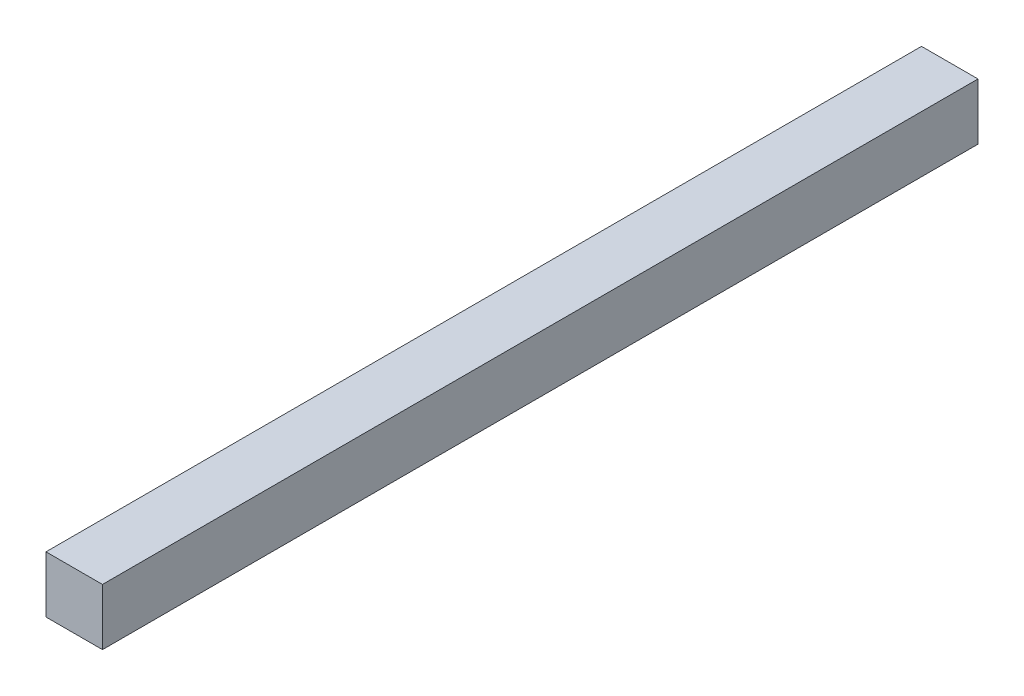
from build123d import *

# Parameters (mm, degrees)
SKETCH1_W           = 20
SKETCH1_H           = 20
BOSS_EXTRUDE1_DEPTH = 310


with BuildPart() as part:
    # Sketch1 → Boss-Extrude1 (new body)
    with BuildSketch(Plane.XY):
        Rectangle(SKETCH1_W, SKETCH1_H)
    extrude(amount=BOSS_EXTRUDE1_DEPTH)


solid = part.part
